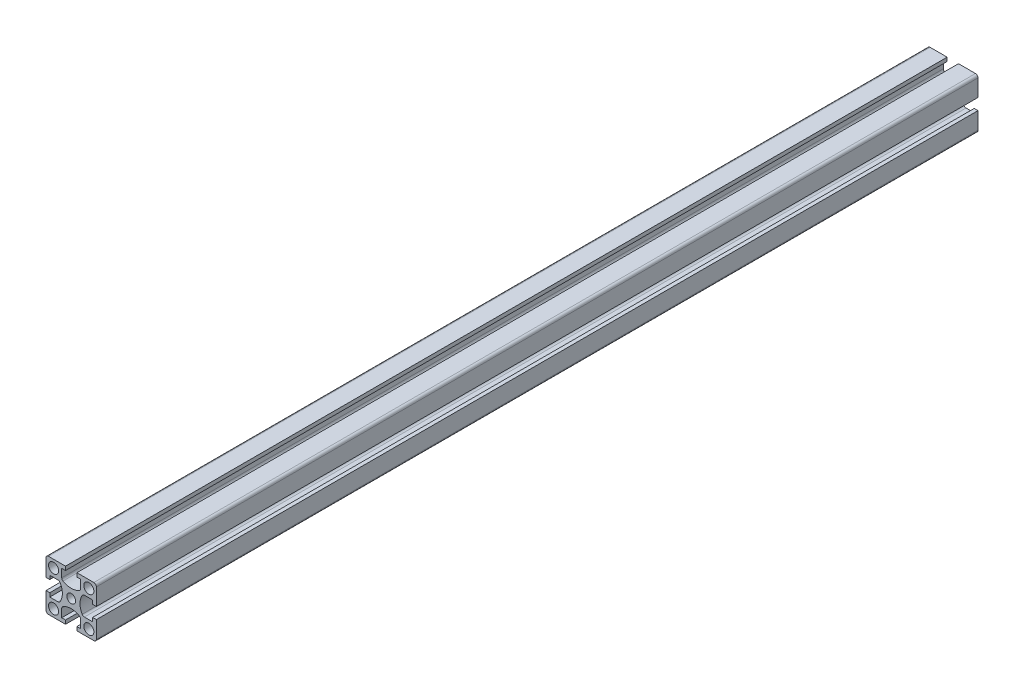
from build123d import *

# Parameters (mm, degrees)
SKETCH1_R           = 2
SKETCH1_R_2         = 1.75
BOSS_EXTRUDE1_DEPTH = 350


with BuildPart() as part:
    # Sketch1 → Boss-Extrude1 (new body)
    with BuildSketch(Plane.XY):
        with BuildLine():
            Line((-10, 9), (-10, 2.25))
            Line((-10, 2.25), (-8.5, 2.25))
            Line((-8.5, 2.25), (-8.5, 3.75))
            Line((-8.5, 3.75), (-5.236860279, 3.75))
            ThreePointArc((-5.236860279, 3.75), (-4.736860279, 3.616025404), (-4.370834875, 3.25))
            ThreePointArc((-4.370834875, 3.25), (-3.5, 0), (-4.370834875, -3.25))
            ThreePointArc((-4.370834875, -3.25), (-4.736860279, -3.616025404), (-5.236860279, -3.75))
            Line((-5.236860279, -3.75), (-8.5, -3.75))
            Line((-8.5, -3.75), (-8.5, -2.25))
            Line((-8.5, -2.25), (-10, -2.25))
            Line((-10, -2.25), (-10, -9))
            ThreePointArc((-10, -9), (-9.707106781, -9.707106781), (-9, -10))
            Line((-9, -10), (-2.25, -10))
            Line((-2.25, -10), (-2.25, -8.5))
            Line((-2.25, -8.5), (-3.75, -8.5))
            Line((-3.75, -8.5), (-3.75, -5.236860279))
            ThreePointArc((-3.75, -5.236860279), (-3.616025404, -4.736860279), (-3.25, -4.370834875))
            ThreePointArc((-3.25, -4.370834875), (0, -3.5), (3.25, -4.370834875))
            ThreePointArc((3.25, -4.370834875), (3.616025404, -4.736860279), (3.75, -5.236860279))
            Line((3.75, -5.236860279), (3.75, -8.5))
            Line((3.75, -8.5), (2.25, -8.5))
            Line((2.25, -8.5), (2.25, -10))
            Line((2.25, -10), (9, -10))
            ThreePointArc((9, -10), (9.707106781, -9.707106781), (10, -9))
            Line((10, -9), (10, -2.25))
            Line((10, -2.25), (8.5, -2.25))
            Line((8.5, -2.25), (8.5, -3.75))
            Line((8.5, -3.75), (5.236860279, -3.75))
            ThreePointArc((5.236860279, -3.75), (4.736860279, -3.616025404), (4.370834875, -3.25))
            ThreePointArc((4.370834875, -3.25), (3.5, 0), (4.370834875, 3.25))
            ThreePointArc((4.370834875, 3.25), (4.736860279, 3.616025404), (5.236860279, 3.75))
            Line((5.236860279, 3.75), (8.5, 3.75))
            Line((8.5, 3.75), (8.5, 2.25))
            Line((8.5, 2.25), (10, 2.25))
            Line((10, 2.25), (10, 9))
            ThreePointArc((10, 9), (9.707106781, 9.707106781), (9, 10))
            Line((9, 10), (2.25, 10))
            Line((2.25, 10), (2.25, 8.5))
            Line((2.25, 8.5), (3.75, 8.5))
            Line((3.75, 8.5), (3.75, 5.236860279))
            ThreePointArc((3.75, 5.236860279), (3.616025404, 4.736860279), (3.25, 4.370834875))
            ThreePointArc((3.25, 4.370834875), (0, 3.5), (-3.25, 4.370834875))
            ThreePointArc((-3.25, 4.370834875), (-3.616025404, 4.736860279), (-3.75, 5.236860279))
            Line((-3.75, 5.236860279), (-3.75, 8.5))
            Line((-3.75, 8.5), (-2.25, 8.5))
            Line((-2.25, 8.5), (-2.25, 10))
            Line((-2.25, 10), (-9, 10))
            ThreePointArc((-9, 10), (-9.707106781, 9.707106781), (-10, 9))
        make_face()
        with Locations((-7, -7)):
            Circle(SKETCH1_R, mode=Mode.SUBTRACT)
        with Locations((7, -7)):
            Circle(SKETCH1_R, mode=Mode.SUBTRACT)
        with Locations((7, 7)):
            Circle(SKETCH1_R, mode=Mode.SUBTRACT)
        Circle(SKETCH1_R_2, mode=Mode.SUBTRACT)
        with Locations((-7, 7)):
            Circle(SKETCH1_R, mode=Mode.SUBTRACT)
    extrude(amount=BOSS_EXTRUDE1_DEPTH)


solid = part.part
